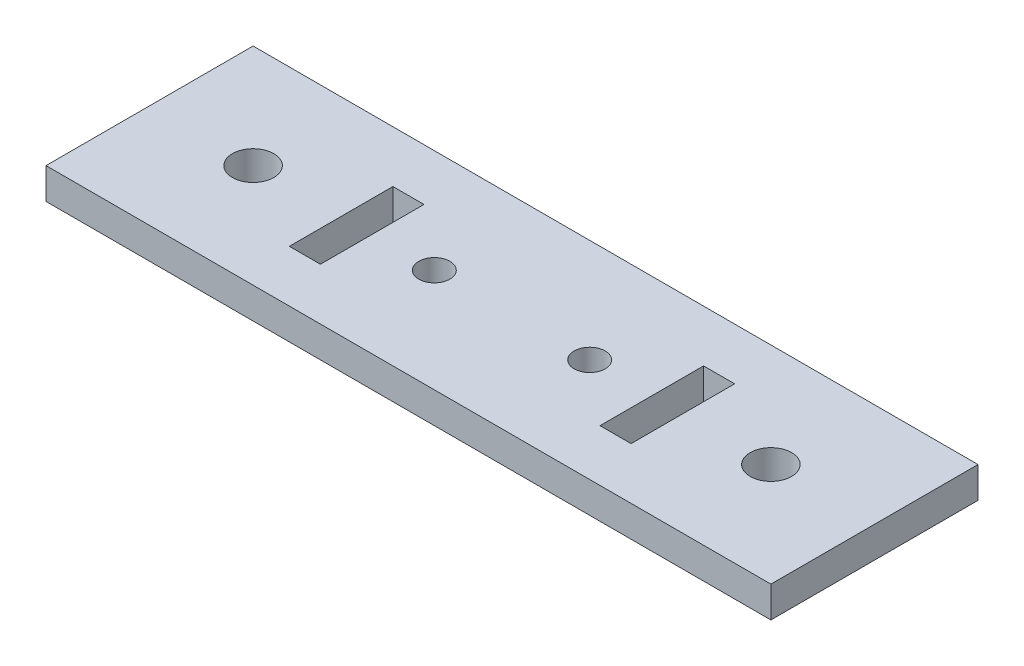
from build123d import *

# Parameters (mm, degrees)
SKETCH1_W           = 70
SKETCH1_H           = 20
SKETCH1_R           = 2
SKETCH1_R_2         = 1.5
SKETCH1_W_2         = 3
SKETCH1_H_2         = 10
BOSS_EXTRUDE1_DEPTH = 3


with BuildPart() as part:
    # Sketch1 → Boss-Extrude1 (new body)
    with BuildSketch(Plane(origin=(0, 0, 0), x_dir=(1, 0, 0), z_dir=(0, 1, 0))):
        with Locations((35, 10)):
            Rectangle(SKETCH1_W, SKETCH1_H)
        with Locations(Location((10, 10, 0), (0, 0, 270))):
            Circle(SKETCH1_R, mode=Mode.SUBTRACT)
        with Locations(Location((27.5, 10, 0), (0, 0, 270))):
            Circle(SKETCH1_R_2, mode=Mode.SUBTRACT)
        with Locations(Location((60, 10, 0), (0, 0, 90))):
            Circle(SKETCH1_R, mode=Mode.SUBTRACT)
        with Locations(Location((42.5, 10, 0), (0, 0, 90))):
            Circle(SKETCH1_R_2, mode=Mode.SUBTRACT)
        with Locations((20, 10)):
            Rectangle(SKETCH1_W_2, SKETCH1_H_2, mode=Mode.SUBTRACT)
        with Locations((50, 10)):
            Rectangle(SKETCH1_W_2, SKETCH1_H_2, mode=Mode.SUBTRACT)
    extrude(amount=BOSS_EXTRUDE1_DEPTH)


solid = part.part
